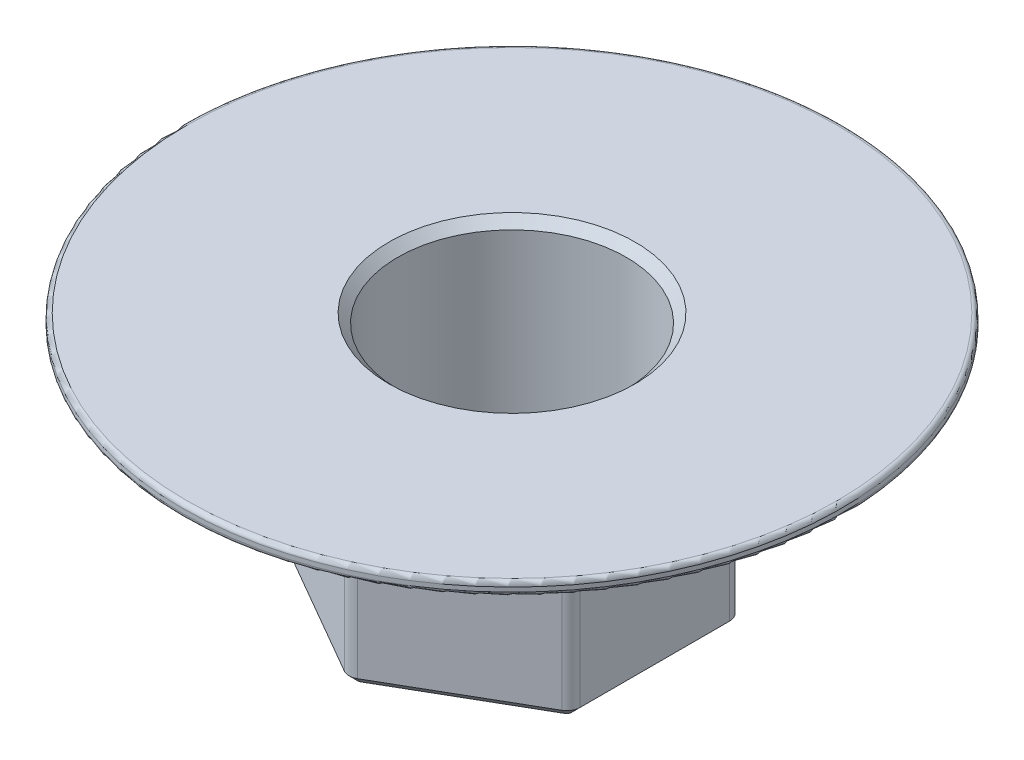
from build123d import *

# Parameters (mm, degrees)
SKETCH2_R               = 75
SKETCH2_R_2             = 26
BOSS_EXTRUDE1_DEPTH     = 55
CUT_EXTRUDE1_DEPTH      = 120.478031453
CUT_EXTRUDE1_DEPTH_BACK = 52
SKETCH3_R               = 75
FILLET1_R               = 3
CHAMFER1_SIZE           = 2
CHAMFER3_SIZE           = 2
FILLET2_R               = 1


with BuildPart() as part:
    # Sketch2 → Boss-Extrude1 (new body)
    with BuildSketch(Plane(origin=(0, 0, 0), x_dir=(1, 0, 0), z_dir=(0, 1, 0))):
        with Locations(Location((0, 0, 0), (0, 0, 270))):
            Circle(SKETCH2_R)
        with Locations(Location((0, 0, 0), (0, 0, 270))):
            Circle(SKETCH2_R_2, mode=Mode.SUBTRACT)
    extrude(amount=BOSS_EXTRUDE1_DEPTH)

    # Sketch3 → Cut-Extrude1 (cut, two sides: drawn at the far end of the back side and taken through both)
    with BuildSketch(Plane.XZ.offset(-CUT_EXTRUDE1_DEPTH_BACK)):
        with Locations(Location((0, 0, 0), (0, 0, 90))):
            Circle(SKETCH3_R)
        Polygon((32.5, -18.763883749), (32.5, 18.763883749), (0, 37.527767497), (-32.5, 18.763883749), (-32.5, -18.763883749), (0, -37.527767497), align=None, mode=Mode.SUBTRACT)
    extrude(amount=CUT_EXTRUDE1_DEPTH + CUT_EXTRUDE1_DEPTH_BACK, mode=Mode.SUBTRACT)

    # Fillet1
    fillet1_edges = [part.edges().sort_by_distance(p)[0] for p in [
        (0, 26, -37.527767497),
        (-32.5, 26, -18.763883749),
        (-32.5, 26, 18.763883749),
        (0, 26, 37.527767497),
        (32.5, 26, 18.763883749),
        (32.5, 26, -18.763883749),
    ]]
    fillet(fillet1_edges, radius=FILLET1_R)

    # Chamfer1
    chamfer1_edges = [part.edges().sort_by_distance(p)[0] for p in [
        (16.25, 0, -28.145825623),
        (32.5, 0, 0),
        (16.25, 0, 28.145825623),
        (-16.25, 0, 28.145825623),
        (-32.5, 0, 0),
        (-16.25, 0, -28.145825623),
        (0, 0, -37.063665882),
        (-32.098076211, 0, -18.531832941),
        (-32.098076211, 0, 18.531832941),
        (0, 0, 37.063665882),
        (32.098076211, 0, 18.531832941),
        (32.098076211, 0, -18.531832941),
    ]]
    chamfer(chamfer1_edges, length=CHAMFER1_SIZE)

    # Chamfer3
    chamfer3_edges = [part.edges().sort_by_distance(p)[0] for p in [
        (0, 55, -26),
    ]]
    chamfer(chamfer3_edges, length=CHAMFER3_SIZE)

    # Fillet2
    fillet2_edges = [part.edges().sort_by_distance(p)[0] for p in [
        (0, 52, -75),
        (0, 55, -75),
    ]]
    fillet(fillet2_edges, radius=FILLET2_R)


solid = part.part
